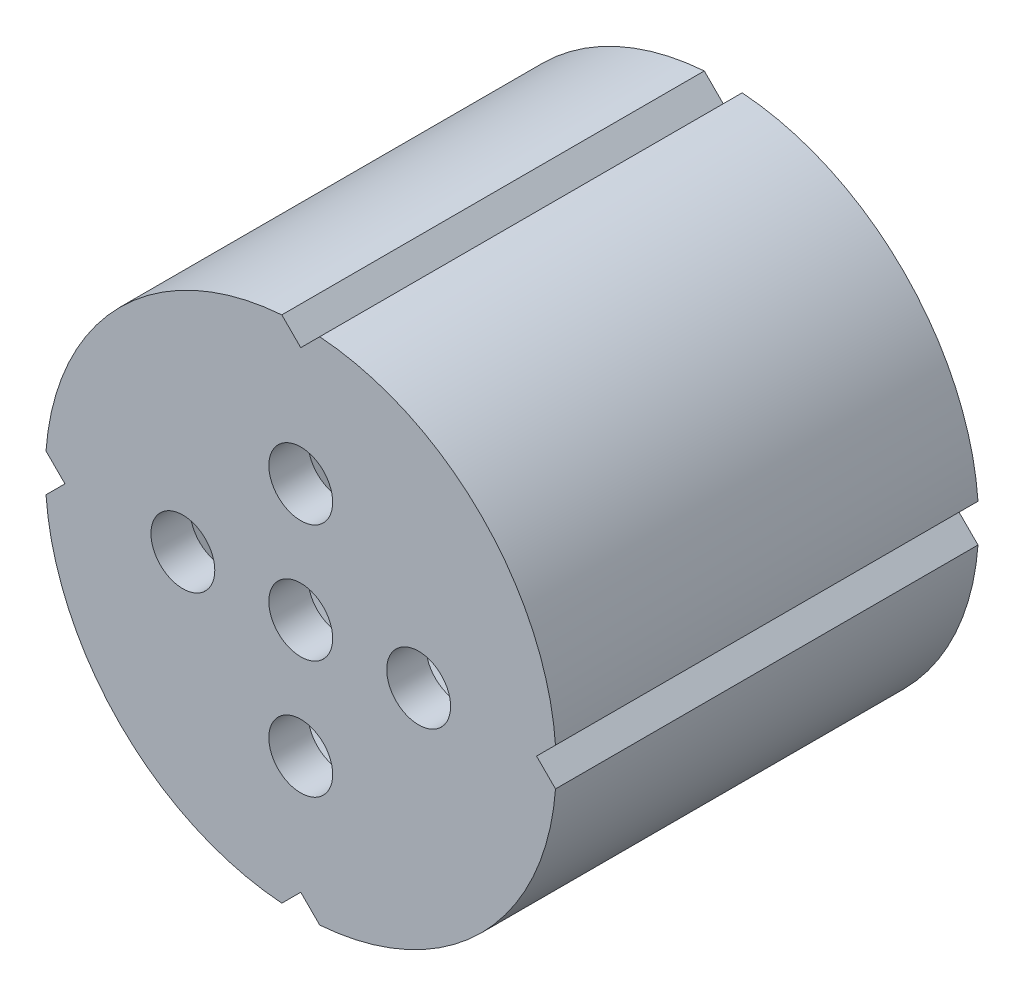
from build123d import *

# Parameters (mm, degrees)
CROQUIS1_R              = 11.5
SALIENTE_EXTRUIR1_DEPTH = 19.5
SALIENTE_EXTRUIR2_START = 2
CROQUIS2_R              = 1.625
SALIENTE_EXTRUIR2_DEPTH = 2


with BuildPart() as part:
    # Croquis1 → Saliente-Extruir1 (new body)
    with BuildSketch(Plane.XY):
        with BuildLine():
            Line((0.964194139, 12.964194139), (0, 12))
            Line((0, 12), (-0.964194139, 12.964194139))
            ThreePointArc((-0.964194139, 12.964194139), (-9.192388155, 9.192388155), (-12.964194139, 0.964194139))
            Line((-12.964194139, 0.964194139), (-12, 0))
            Line((-12, 0), (-12.964194139, -0.964194139))
            ThreePointArc((-12.964194139, -0.964194139), (-9.192388155, -9.192388155), (-0.964194139, -12.964194139))
            Line((-0.964194139, -12.964194139), (0, -12))
            Line((0, -12), (0.964194139, -12.964194139))
            ThreePointArc((0.964194139, -12.964194139), (9.192388155, -9.192388155), (12.964194139, -0.964194139))
            Line((12.964194139, -0.964194139), (12, 0))
            Line((12, 0), (12.964194139, 0.964194139))
            ThreePointArc((12.964194139, 0.964194139), (9.192388155, 9.192388155), (0.964194139, 12.964194139))
        make_face()
        Circle(CROQUIS1_R, mode=Mode.SUBTRACT)
    extrude(amount=-SALIENTE_EXTRUIR1_DEPTH)

    # Croquis2 → Saliente-Extruir2 (add)
    with BuildSketch(Plane.XY.offset(SALIENTE_EXTRUIR2_START)):
        with BuildLine():
            Line((-12.964194139, -0.964194139), (-12, 0))
            Line((-12, 0), (-12.964194139, 0.964194139))
            ThreePointArc((-12.964194139, 0.964194139), (-9.192388155, 9.192388155), (-0.964194139, 12.964194139))
            Line((-0.964194139, 12.964194139), (0, 12))
            Line((0, 12), (0.964194139, 12.964194139))
            ThreePointArc((0.964194139, 12.964194139), (9.192388155, 9.192388155), (12.964194139, 0.964194139))
            Line((12.964194139, 0.964194139), (12, 0))
            Line((12, 0), (12.964194139, -0.964194139))
            ThreePointArc((12.964194139, -0.964194139), (9.192388155, -9.192388155), (0.964194139, -12.964194139))
            Line((0.964194139, -12.964194139), (0, -12))
            Line((0, -12), (-0.964194139, -12.964194139))
            ThreePointArc((-0.964194139, -12.964194139), (-9.192388155, -9.192388155), (-12.964194139, -0.964194139))
        make_face()
        Circle(CROQUIS2_R, mode=Mode.SUBTRACT)
        with Locations((6, 0)):
            Circle(CROQUIS2_R, mode=Mode.SUBTRACT)
        with Locations((-6, 0)):
            Circle(CROQUIS2_R, mode=Mode.SUBTRACT)
        with Locations((0, 6)):
            Circle(CROQUIS2_R, mode=Mode.SUBTRACT)
        with Locations((0, -6)):
            Circle(CROQUIS2_R, mode=Mode.SUBTRACT)
    extrude(amount=-SALIENTE_EXTRUIR2_DEPTH)


solid = part.part
